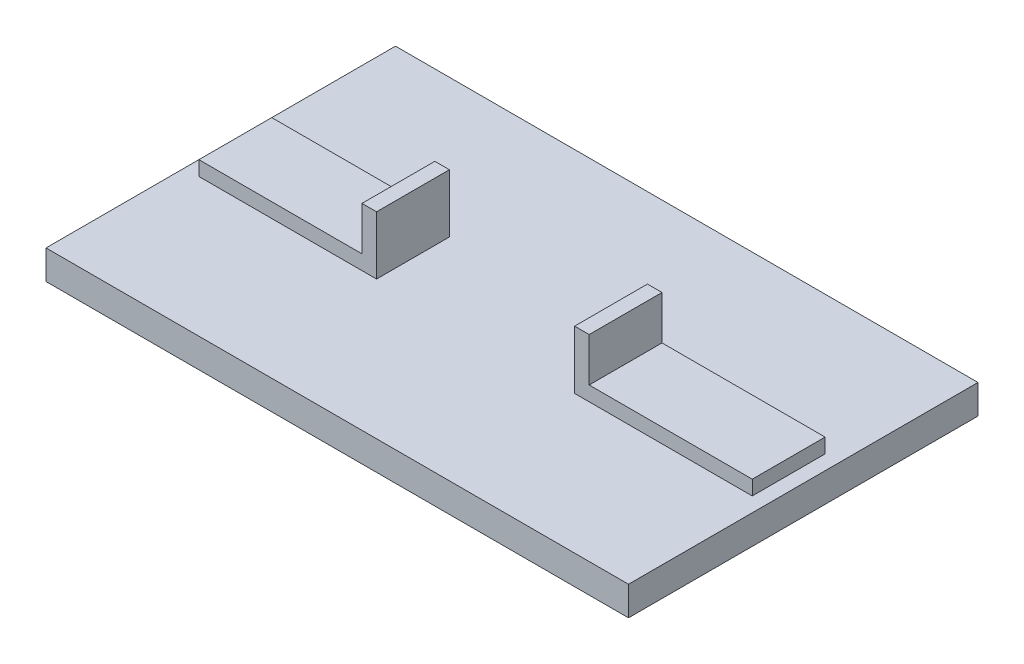
from build123d import *

# Parameters (mm, degrees)
SKETCH2_W           = 100
SKETCH2_H           = 60
BOSS_EXTRUDE1_DEPTH = 5
SKETCH4_W           = 28
SKETCH4_H           = 12.508
BOSS_EXTRUDE2_DEPTH = 2.5
SKETCH5_W           = 2.5
SKETCH5_H           = 12.508
BOSS_EXTRUDE3_DEPTH = 10


with BuildPart() as part:
    # Sketch2 → Boss-Extrude1 (new body)
    with BuildSketch(Plane(origin=(0, 0, 0), x_dir=(1, 0, 0), z_dir=(0, 1, 0))):
        Rectangle(SKETCH2_W, SKETCH2_H)
    extrude(amount=BOSS_EXTRUDE1_DEPTH)

    # Sketch4 → Boss-Extrude2 (add)
    with BuildSketch(Plane(origin=(0, 5, 0), x_dir=(1, 0, 0), z_dir=(0, 1, 0))):
        with Locations((-33.5, 0)):
            Rectangle(SKETCH4_W, SKETCH4_H)
        with Locations((33.5, 0)):
            Rectangle(SKETCH4_W, SKETCH4_H)
    extrude(amount=BOSS_EXTRUDE2_DEPTH)

    # Sketch5 → Boss-Extrude3 (add)
    with BuildSketch(Plane(origin=(0, 5, 0), x_dir=(1, 0, 0), z_dir=(0, 1, 0))):
        with Locations((-18.25, 0)):
            Rectangle(SKETCH5_W, SKETCH5_H)
        with Locations((18.25, 0)):
            Rectangle(SKETCH5_W, SKETCH5_H)
    extrude(amount=BOSS_EXTRUDE3_DEPTH)


solid = part.part
